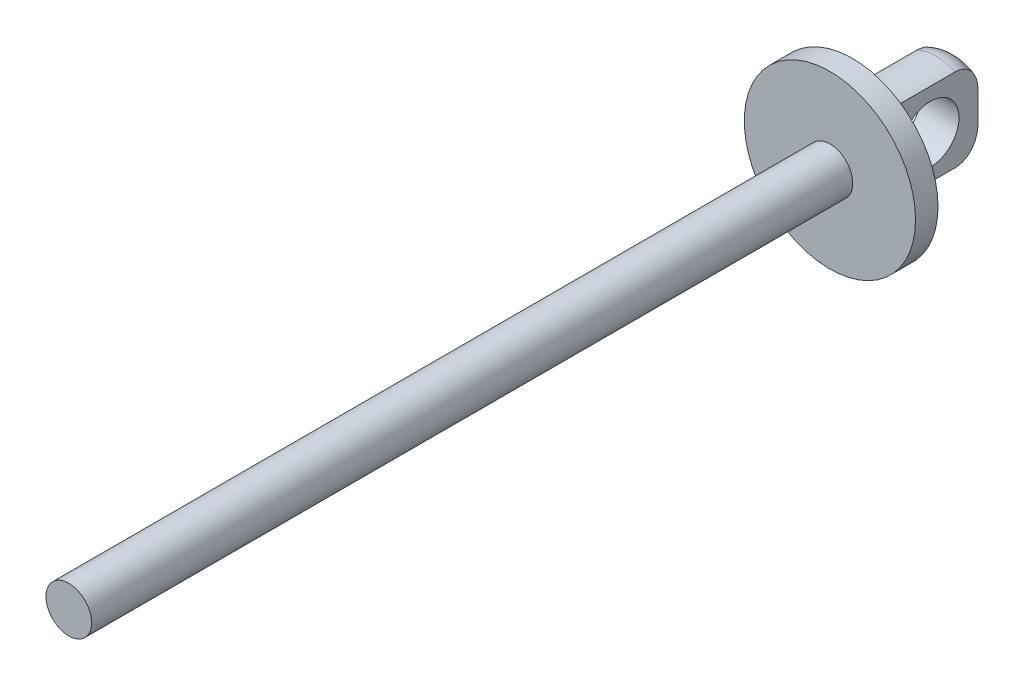
from build123d import *

# Parameters (mm, degrees)
SKETCH1_R               = 22.5
BOSS_EXTRUDE1_DEPTH     = 5.91
SKETCH2_R               = 6
BOSS_EXTRUDE2_DEPTH     = 200
SKETCH3_R               = 12
BOSS_EXTRUDE3_DEPTH     = 28
FILLET1_R               = 6
CUT_EXTRUDE1_DEPTH      = 209.354093072
CUT_EXTRUDE1_DEPTH_BACK = 209.354093072
SKETCH4_W               = 21.071752118
SKETCH4_H               = 26
SKETCH5_R               = 7.5
CUT_EXTRUDE2_DEPTH      = 209.953172027


with BuildPart() as part:
    # Sketch1 → Boss-Extrude1 (new body)
    with BuildSketch(Plane.XY):
        Circle(SKETCH1_R)
    extrude(amount=BOSS_EXTRUDE1_DEPTH)

    # Sketch2 → Boss-Extrude2 (add)
    with BuildSketch(Plane.XY.offset(5.91)):
        Circle(SKETCH2_R)
    extrude(amount=BOSS_EXTRUDE2_DEPTH)

    # Sketch3 → Boss-Extrude3 (add)
    with BuildSketch(Plane(origin=(0, 0, 0), x_dir=(-1, 0, 0), z_dir=(0, 0, -1))):
        with Locations(Location((0, 0, 0), (0, 0, 180))):
            Circle(SKETCH3_R)
    extrude(amount=BOSS_EXTRUDE3_DEPTH)

    # Fillet1
    fillet1_edges = [part.edges().sort_by_distance(p)[0] for p in [
        (-12, 0, -28),
    ]]
    fillet(fillet1_edges, radius=FILLET1_R)

    # Sketch4 → Cut-Extrude1 (cut, two sides: drawn at the far end of the back side and taken through both)
    with BuildSketch(Plane(origin=(0, 0, 0), x_dir=(1, 0, 0), z_dir=(0, 1, 0)).offset(-CUT_EXTRUDE1_DEPTH_BACK)):
        with Locations((-15.535876059, 16)):
            Rectangle(SKETCH4_W, SKETCH4_H)
        with Locations((15.535876059, 16)):
            Rectangle(SKETCH4_W, SKETCH4_H)
    extrude(amount=CUT_EXTRUDE1_DEPTH + CUT_EXTRUDE1_DEPTH_BACK, mode=Mode.SUBTRACT)

    # Sketch5 → Cut-Extrude2 (cut, through all)
    with BuildSketch(Plane(origin=(5, 0, 0), x_dir=(0, 0, -1), z_dir=(1, 0, 0))):
        with Locations((15.5, 0)):
            Circle(SKETCH5_R)
    extrude(amount=-CUT_EXTRUDE2_DEPTH, mode=Mode.SUBTRACT)


solid = part.part
